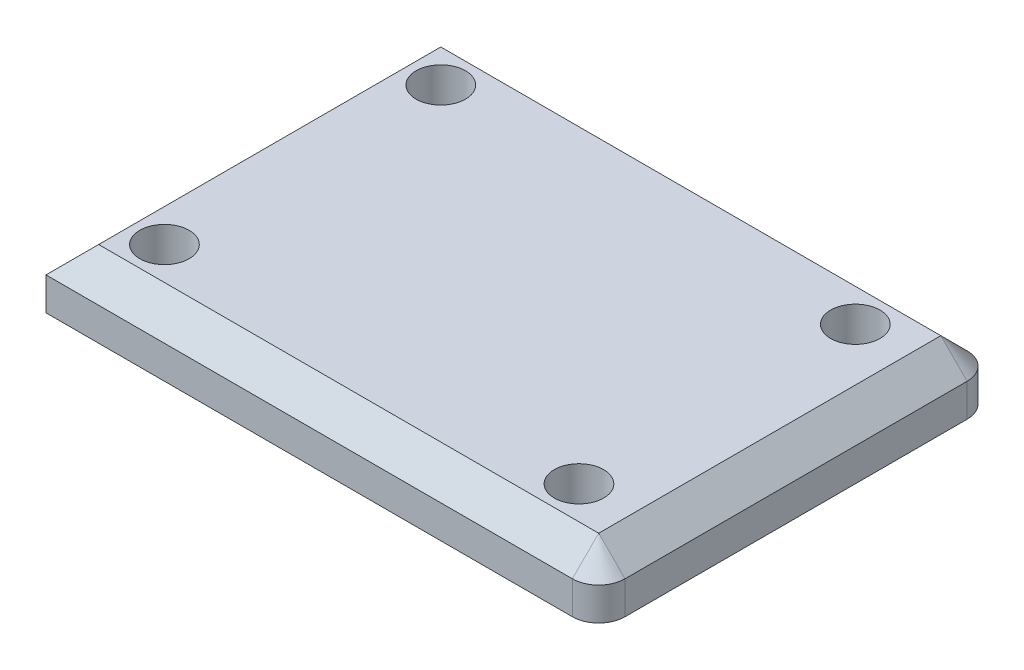
from build123d import *

# Parameters (mm, degrees)
SKETCH1_W           = 28
SKETCH1_H           = 20
BOSS_EXTRUDE1_DEPTH = 3
M3_TAPPED_HOLE1_D   = 2.5
SCALE1_SCALE        = 1.5
FILLET1_R           = 2
CHAMFER1_SIZE       = 2


with BuildPart() as part:
    # Sketch1 → Boss-Extrude1 (new body)
    with BuildSketch(Plane(origin=(0, 0, 0), x_dir=(1, 0, 0), z_dir=(0, 1, 0))):
        Rectangle(SKETCH1_W, SKETCH1_H)
    extrude(amount=BOSS_EXTRUDE1_DEPTH)

    # M3 Tapped Hole1 (through all)
    with Locations(Plane(origin=(0, 3, 0), x_dir=(1, 0, 0), z_dir=(0, 1, 0))):
        with Locations((-11, 7), (-11, -7), (10, -7), (10, 7)):
            Hole(M3_TAPPED_HOLE1_D / 2)


with BuildPart() as part_1:
    # Scale1: scaled about (0.018168231, 1.5, 0)
    add(part.part.scale(SCALE1_SCALE).moved(Location((-0.009084115, -0.75, 0))))

    # Fillet1
    fillet1_edges = [part_1.edges().sort_by_distance(p)[0] for p in [
        (20.990915884, 1.5, -15),
        (20.990915884, 1.5, 15),
    ]]
    fillet(fillet1_edges, radius=FILLET1_R)

    # Chamfer1
    chamfer1_edges = [part_1.edges().sort_by_distance(p)[0] for p in [
        (20.990915884, 3.75, 0),
        (-1.009084116, 3.75, -15),
        (20.405129447, 3.75, -14.414213562),
        (20.405129447, 3.75, 14.414213562),
        (-21.009084116, 3.75, 0),
        (-1.009084116, 3.75, 15),
    ]]
    chamfer(chamfer1_edges, length=CHAMFER1_SIZE)


solid = part_1.part
